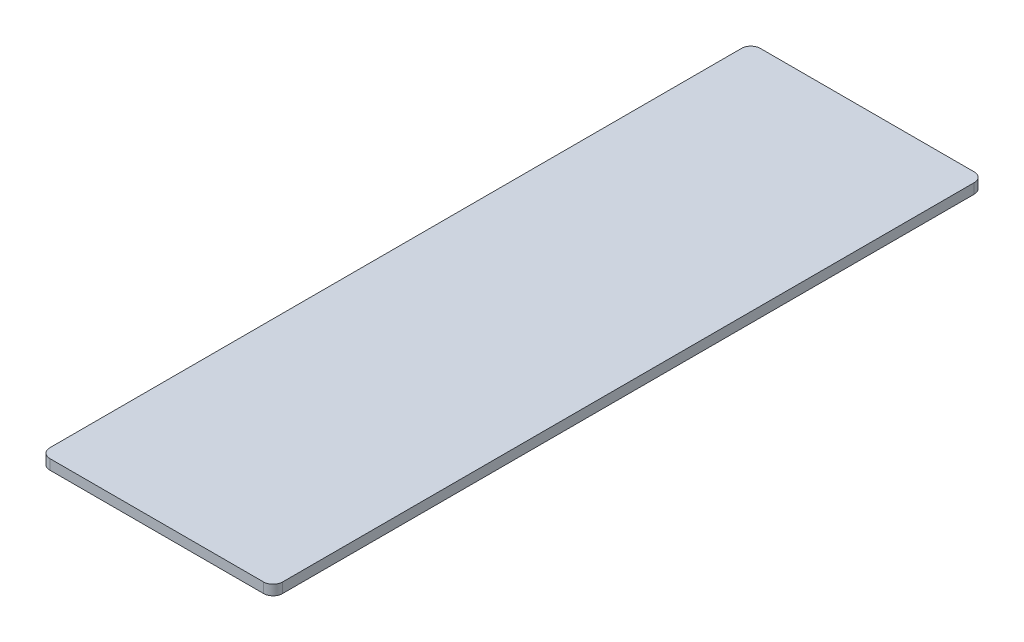
from build123d import *

# Parameters (mm, degrees)
SKETCH_1_W      = 37
SKETCH_1_H      = 113
EXTRUDE_1_DEPTH = 1.6
FILLET_1_R      = 1.5


with BuildPart() as part:
    # 草图1 → 凸台-拉伸1 (new body)
    with BuildSketch(Plane(origin=(0, 0, 0), x_dir=(1, 0, 0), z_dir=(0, 1, 0))):
        with Locations((43.780625722, -56.5)):
            Rectangle(SKETCH_1_W, SKETCH_1_H)
    extrude(amount=EXTRUDE_1_DEPTH)

    # 圆角1
    fillet_1_edges = [part.edges().sort_by_distance(p)[0] for p in [
        (25.280625722, 0.8, 0),
        (62.280625722, 0.8, 0),
        (62.280625722, 0.8, 113),
        (25.280625722, 0.8, 113),
    ]]
    fillet(fillet_1_edges, radius=FILLET_1_R)


solid = part.part
